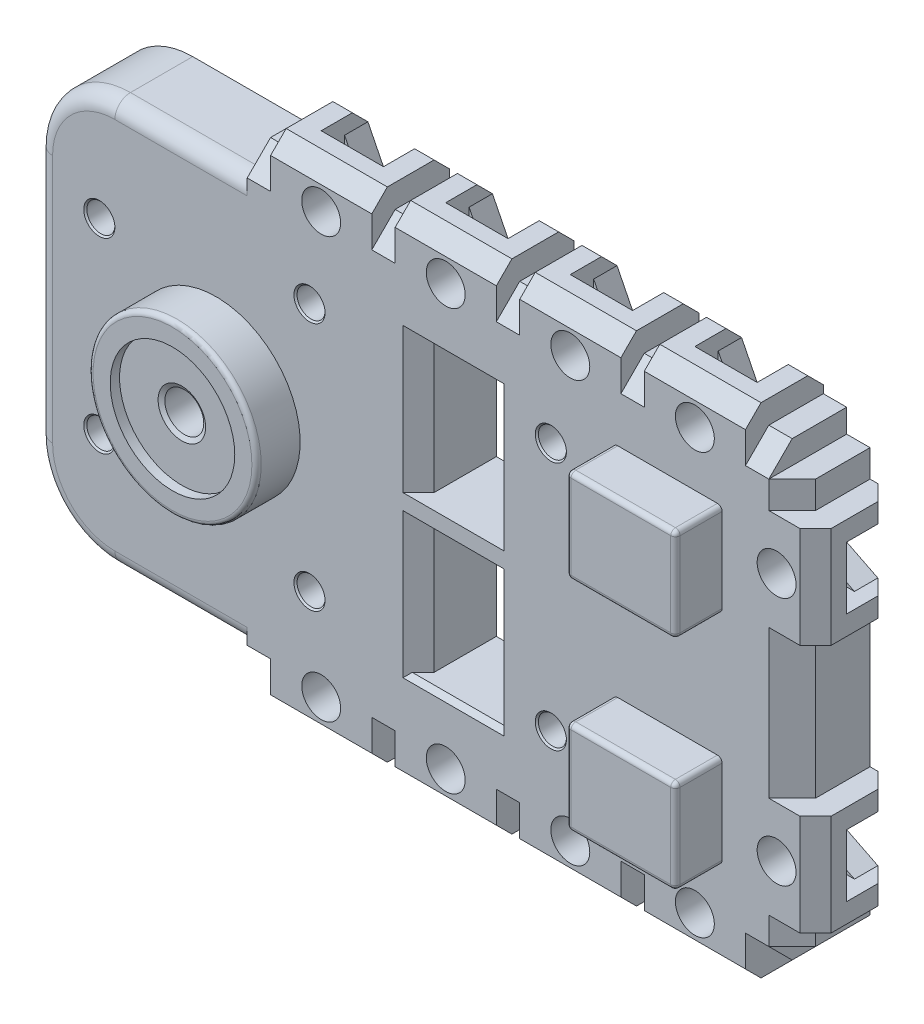
from build123d import *

# Parameters (mm, degrees)
BOSS_EXTRUDE1_DEPTH                  = 2.5
SKETCH5_W                            = 7
SKETCH5_H                            = 6
BOSS_EXTRUDE3_DEPTH                  = 3
SKETCH6_W                            = 3
SKETCH6_H                            = 4
CUT_EXTRUDE3_DEPTH                   = 1
CUT_EXTRUDE4_DEPTH                   = 1.5
CUT_EXTRUDE5_REACH                   = 44.453
SKETCH10_W                           = 4
SKETCH10_H                           = 3
CUT_EXTRUDE6_DEPTH                   = 1
CUT_EXTRUDE7_DEPTH                   = 1.5
CUT_EXTRUDE8_REACH                   = 44.453
CUT_EXTRUDE9_REACH                   = 43.991
SKETCH13_R                           = 1.25
CUT_EXTRUDE10_REACH                  = 43.991
SKETCH14_R                           = 1.25
LPATTERN1_COUNT                      = 4
LPATTERN1_PITCH                      = 8
MIRROR1_COPY_1_SKETCH_W              = 4
MIRROR1_COPY_1_SKETCH_H              = 3
MIRROR1_COPY_1_DEPTH                 = 1
MIRROR1_COPY_2_SKETCH_W              = 4
MIRROR1_COPY_2_SKETCH_H              = 3
MIRROR1_COPY_2_DEPTH                 = 1
MIRROR1_COPY_3_SKETCH_W              = 4
MIRROR1_COPY_3_SKETCH_H              = 3
MIRROR1_COPY_3_DEPTH                 = 1
MIRROR1_COPY_4_DEPTH                 = 1.5
MIRROR1_COPY_5_DEPTH                 = 1.5
MIRROR1_COPY_6_DEPTH                 = 1.5
MIRROR1_COPY_7_REACH                 = 44.453
MIRROR1_COPY_8_REACH                 = 44.453
MIRROR1_COPY_9_REACH                 = 44.453
MIRROR1_COPY_10_REACH                = 43.991
MIRROR1_COPY_10_SKETCH_R             = 1.25
MIRROR1_COPY_11_REACH                = 43.991
MIRROR1_COPY_11_SKETCH_R             = 1.25
MIRROR1_COPY_12_REACH                = 43.991
MIRROR1_COPY_12_SKETCH_R             = 1.25
FILLET1_R                            = 5
SKETCH2_W                            = 4.5
SKETCH2_H                            = 9
CUT_EXTRUDE1_DEPTH                   = 42.991070479
SKETCH3_R                            = 5.4
BOSS_EXTRUDE4_DEPTH                  = 2.8
SKETCH17_R                           = 4
CUT_EXTRUDE13_DEPTH                  = 0.6
F_1_6_1_6_DIAMETER_HOLE1_D           = 1.6
F_1_6_1_6_DIAMETER_HOLE1_DEPTH       = 4.5
F_1_6_1_6_DIAMETER_HOLE1_CSINK_D     = 1.8
F_1_6_1_6_DIAMETER_HOLE1_CSINK_ANGLE = 120
F_1_6_1_6_DIAMETER_HOLE1_TIP         = 0.480688495
M3_TAPPED_HOLE1_D                    = 2.5
M3_TAPPED_HOLE1_CSINK_D              = 3.05
M3_TAPPED_HOLE1_CSINK_ANGLE          = 120
F_1_8_1_8_DIAMETER_HOLE1_D           = 1.8
F_1_8_1_8_DIAMETER_HOLE1_CSINK_D     = 2
F_1_8_1_8_DIAMETER_HOLE1_CSINK_ANGLE = 90
FILLET2_R                            = 1
CHAMFER1_SIZE                        = 1
CHAMFER2_SIZE                        = 1.5
CHAMFER3_SIZE                        = 1
CHAMFER4_SIZE                        = 0.3
FILLET3_R                            = 0.3


with BuildPart() as part:
    # Sketch1 → Boss-Extrude1 (new, symmetric)
    with BuildSketch(Plane.XY):
        Polygon((37, -13), (35.5, -13), (35.5, -14.5), (34, -14.5), (34, -16), (27.5, -16), (27.5, -14.5), (26, -14.5), (26, -16), (19.5, -16), (19.5, -14.5), (18, -14.5), (18, -16), (11.5, -16), (11.5, -14.5), (10, -14.5), (10, -16), (3.5, -16), (3.5, -14.5), (2, -14.5), (2, -13), (-11.5, -13), (-11.5, 13), (2, 13), (2, 14.5), (3.5, 14.5), (3.5, 16), (10, 16), (10, 14.5), (11.5, 14.5), (11.5, 16), (18, 16), (18, 14.5), (19.5, 14.5), (19.5, 16), (26, 16), (26, 14.5), (27.5, 14.5), (27.5, 16), (34, 16), (34, 14.5), (35.5, 14.5), (35.5, 13), (37, 13), (37, 11.25), (38.5, 11.25), (38.5, 4.75), (37, 4.75), (37, -4.75), (38.5, -4.75), (38.5, -11.25), (37, -11.25), align=None)
    extrude(amount=BOSS_EXTRUDE1_DEPTH, both=True)

    # Sketch5 → Boss-Extrude3 (add)
    with BuildSketch(Plane.XY.offset(2.5)):
        with Locations((29, 7)):
            Rectangle(SKETCH5_W, SKETCH5_H)
        with Locations((29, -7)):
            Rectangle(SKETCH5_W, SKETCH5_H)
    extrude(amount=BOSS_EXTRUDE3_DEPTH)

    # Sketch6 → Cut-Extrude3 (cut)
    with BuildSketch(Plane(origin=(38.5, 0, 0), x_dir=(0, 0, -1), z_dir=(1, 0, 0))):
        with Locations((1, 8)):
            Rectangle(SKETCH6_W, SKETCH6_H)
    cut_extrude3 = extrude(amount=-CUT_EXTRUDE3_DEPTH, mode=Mode.SUBTRACT)

    # Sketch7 → Cut-Extrude4 (cut)
    with BuildSketch(Plane(origin=(0, 0, 0.5), x_dir=(-1, 0, 0), z_dir=(0, 0, -1))):
        Polygon((-37.154700538, 6), (-34.845299462, 6), (-33.690598923, 8), (-34.845299462, 10), (-37.154700538, 10), (-38.5, 10), (-38.5, 6), align=None)
    cut_extrude4 = extrude(amount=CUT_EXTRUDE4_DEPTH, mode=Mode.SUBTRACT)

    # Sketch8 → Cut-Extrude5 (cut, up to next)
    with BuildSketch(Plane(origin=(0, 0, -2.5), x_dir=(-1, 0, 0), z_dir=(0, 0, -1)), mode=Mode.PRIVATE) as cut_extrude5_sk1:
        Polygon((-37.5, 10), (-35.5, 9), (-35.5, 7), (-37.5, 6), align=None)
    cut_extrude5_tool1 = extrude(cut_extrude5_sk1.sketch, amount=-CUT_EXTRUDE5_REACH, mode=Mode.PRIVATE) & part.part
    cut_extrude5 = cut_extrude5_tool1.solids().sort_by_distance((36.611111, 8, -2.5))[0]
    add(cut_extrude5, mode=Mode.SUBTRACT)

    # Sketch10 → Cut-Extrude6 (cut)
    with BuildSketch(Plane(origin=(0, 16, 0), x_dir=(1, 0, 0), z_dir=(0, 1, 0))):
        with Locations((30.75, 1)):
            Rectangle(SKETCH10_W, SKETCH10_H)
    cut_extrude6 = extrude(amount=-CUT_EXTRUDE6_DEPTH, mode=Mode.SUBTRACT)

    # Sketch11 → Cut-Extrude7 (cut)
    with BuildSketch(Plane(origin=(0, 0, 0.5), x_dir=(-1, 0, 0), z_dir=(0, 0, -1))):
        Polygon((-32.75, 14.654700538), (-32.75, 12.345299462), (-30.75, 11.190598923), (-28.75, 12.345299462), (-28.75, 14.654700538), (-28.75, 16), (-32.75, 16), align=None)
    cut_extrude7 = extrude(amount=CUT_EXTRUDE7_DEPTH, mode=Mode.SUBTRACT)

    # Sketch12 → Cut-Extrude8 (cut, up to next)
    with BuildSketch(Plane(origin=(0, 0, -2.5), x_dir=(-1, 0, 0), z_dir=(0, 0, -1)), mode=Mode.PRIVATE) as cut_extrude8_sk1:
        Polygon((-28.75, 15), (-29.75, 13), (-31.75, 13), (-32.75, 15), align=None)
    cut_extrude8_tool1 = extrude(cut_extrude8_sk1.sketch, amount=-CUT_EXTRUDE8_REACH, mode=Mode.PRIVATE) & part.part
    cut_extrude8 = cut_extrude8_tool1.solids().sort_by_distance((30.75, 14.111111, -2.5))[0]
    add(cut_extrude8, mode=Mode.SUBTRACT)

    # Sketch13 → Cut-Extrude9 (cut, up to next)
    with BuildSketch(Plane.XY.offset(2.5), mode=Mode.PRIVATE) as cut_extrude9_sk1:
        with Locations((36, 8)):
            Circle(SKETCH13_R)
    cut_extrude9_tool1 = extrude(cut_extrude9_sk1.sketch, amount=-CUT_EXTRUDE9_REACH, mode=Mode.PRIVATE) & part.part
    cut_extrude9 = cut_extrude9_tool1.solids().sort_by_distance((36, 8, 2.5))[0]
    add(cut_extrude9, mode=Mode.SUBTRACT)

    # Sketch14 → Cut-Extrude10 (cut, up to next)
    with BuildSketch(Plane.XY.offset(2.5), mode=Mode.PRIVATE) as cut_extrude10_sk1:
        with Locations((30.75, 13.5)):
            Circle(SKETCH14_R)
    cut_extrude10_tool1 = extrude(cut_extrude10_sk1.sketch, amount=-CUT_EXTRUDE10_REACH, mode=Mode.PRIVATE) & part.part
    cut_extrude10 = cut_extrude10_tool1.solids().sort_by_distance((30.75, 13.5, 2.5))[0]
    add(cut_extrude10, mode=Mode.SUBTRACT)

    # LPattern1: Cut-Extrude6, Cut-Extrude7, Cut-Extrude8, Cut-Extrude10 ×4
    with Locations(*[(-i * LPATTERN1_PITCH, 0, 0) for i in range(1, LPATTERN1_COUNT)]):
        add(cut_extrude6, mode=Mode.SUBTRACT)
        add(cut_extrude7, mode=Mode.SUBTRACT)
        add(cut_extrude8, mode=Mode.SUBTRACT)
        add(cut_extrude10, mode=Mode.SUBTRACT)

    # Mirror1: Cut-Extrude3, Cut-Extrude4, Cut-Extrude5, Cut-Extrude6, Cut-Extrude7, Cut-Extrude8, Cut-Extrude9, Cut-Extrude10 across plane
    add(cut_extrude3.mirror(Plane.ZX), mode=Mode.SUBTRACT)
    add(cut_extrude4.mirror(Plane.ZX), mode=Mode.SUBTRACT)
    add(cut_extrude5.mirror(Plane.ZX), mode=Mode.SUBTRACT)
    add(cut_extrude6.mirror(Plane.ZX), mode=Mode.SUBTRACT)
    add(cut_extrude7.mirror(Plane.ZX), mode=Mode.SUBTRACT)
    add(cut_extrude8.mirror(Plane.ZX), mode=Mode.SUBTRACT)
    add(cut_extrude9.mirror(Plane.ZX), mode=Mode.SUBTRACT)
    add(cut_extrude10.mirror(Plane.ZX), mode=Mode.SUBTRACT)

    # Mirror1 copy 1 sketch → Mirror1 copy 1 (cut)
    with BuildSketch(Plane(origin=(-8, -16, 0), x_dir=(1, 0, 0), z_dir=(0, -1, 0))):
        with Locations((30.75, -1)):
            Rectangle(MIRROR1_COPY_1_SKETCH_W, MIRROR1_COPY_1_SKETCH_H)
    extrude(amount=-MIRROR1_COPY_1_DEPTH, mode=Mode.SUBTRACT)

    # Mirror1 copy 2 sketch → Mirror1 copy 2 (cut)
    with BuildSketch(Plane(origin=(-16, -16, 0), x_dir=(1, 0, 0), z_dir=(0, -1, 0))):
        with Locations((30.75, -1)):
            Rectangle(MIRROR1_COPY_2_SKETCH_W, MIRROR1_COPY_2_SKETCH_H)
    extrude(amount=-MIRROR1_COPY_2_DEPTH, mode=Mode.SUBTRACT)

    # Mirror1 copy 3 sketch → Mirror1 copy 3 (cut)
    with BuildSketch(Plane(origin=(-24, -16, 0), x_dir=(1, 0, 0), z_dir=(0, -1, 0))):
        with Locations((30.75, -1)):
            Rectangle(MIRROR1_COPY_3_SKETCH_W, MIRROR1_COPY_3_SKETCH_H)
    extrude(amount=-MIRROR1_COPY_3_DEPTH, mode=Mode.SUBTRACT)

    # Mirror1 copy 4 sketch → Mirror1 copy 4 (cut)
    with BuildSketch(Plane(origin=(-8, 0, 0.5), x_dir=(-1, 0, 0), z_dir=(0, 0, -1))):
        Polygon((-32.75, -14.654700538), (-32.75, -12.345299462), (-30.75, -11.190598923), (-28.75, -12.345299462), (-28.75, -14.654700538), (-28.75, -16), (-32.75, -16), align=None)
    extrude(amount=MIRROR1_COPY_4_DEPTH, mode=Mode.SUBTRACT)

    # Mirror1 copy 5 sketch → Mirror1 copy 5 (cut)
    with BuildSketch(Plane(origin=(-16, 0, 0.5), x_dir=(-1, 0, 0), z_dir=(0, 0, -1))):
        Polygon((-32.75, -14.654700538), (-32.75, -12.345299462), (-30.75, -11.190598923), (-28.75, -12.345299462), (-28.75, -14.654700538), (-28.75, -16), (-32.75, -16), align=None)
    extrude(amount=MIRROR1_COPY_5_DEPTH, mode=Mode.SUBTRACT)

    # Mirror1 copy 6 sketch → Mirror1 copy 6 (cut)
    with BuildSketch(Plane(origin=(-24, 0, 0.5), x_dir=(-1, 0, 0), z_dir=(0, 0, -1))):
        Polygon((-32.75, -14.654700538), (-32.75, -12.345299462), (-30.75, -11.190598923), (-28.75, -12.345299462), (-28.75, -14.654700538), (-28.75, -16), (-32.75, -16), align=None)
    extrude(amount=MIRROR1_COPY_6_DEPTH, mode=Mode.SUBTRACT)

    # Mirror1 copy 7 sketch → Mirror1 copy 7 (cut, up to next)
    with BuildSketch(Plane(origin=(-8, 0, -2.5), x_dir=(-1, 0, 0), z_dir=(0, 0, -1)), mode=Mode.PRIVATE) as mirror1_copy_7_sk1:
        Polygon((-28.75, -15), (-29.75, -13), (-31.75, -13), (-32.75, -15), align=None)
    mirror1_copy_7_tool1 = extrude(mirror1_copy_7_sk1.sketch, amount=-MIRROR1_COPY_7_REACH, mode=Mode.PRIVATE) & part.part
    add(mirror1_copy_7_tool1.solids().sort_by_distance((22.75, -14.111111, -2.5))[0], mode=Mode.SUBTRACT)

    # Mirror1 copy 8 sketch → Mirror1 copy 8 (cut, up to next)
    with BuildSketch(Plane(origin=(-16, 0, -2.5), x_dir=(-1, 0, 0), z_dir=(0, 0, -1)), mode=Mode.PRIVATE) as mirror1_copy_8_sk1:
        Polygon((-28.75, -15), (-29.75, -13), (-31.75, -13), (-32.75, -15), align=None)
    mirror1_copy_8_tool1 = extrude(mirror1_copy_8_sk1.sketch, amount=-MIRROR1_COPY_8_REACH, mode=Mode.PRIVATE) & part.part
    add(mirror1_copy_8_tool1.solids().sort_by_distance((14.75, -14.111111, -2.5))[0], mode=Mode.SUBTRACT)

    # Mirror1 copy 9 sketch → Mirror1 copy 9 (cut, up to next)
    with BuildSketch(Plane(origin=(-24, 0, -2.5), x_dir=(-1, 0, 0), z_dir=(0, 0, -1)), mode=Mode.PRIVATE) as mirror1_copy_9_sk1:
        Polygon((-28.75, -15), (-29.75, -13), (-31.75, -13), (-32.75, -15), align=None)
    mirror1_copy_9_tool1 = extrude(mirror1_copy_9_sk1.sketch, amount=-MIRROR1_COPY_9_REACH, mode=Mode.PRIVATE) & part.part
    add(mirror1_copy_9_tool1.solids().sort_by_distance((6.75, -14.111111, -2.5))[0], mode=Mode.SUBTRACT)

    # Mirror1 copy 10 sketch → Mirror1 copy 10 (cut, up to next)
    with BuildSketch(Plane(origin=(-8, 0, 2.5), x_dir=(1, 0, 0), z_dir=(0, 0, 1)), mode=Mode.PRIVATE) as mirror1_copy_10_sk1:
        with Locations((30.75, -13.5)):
            Circle(MIRROR1_COPY_10_SKETCH_R)
    mirror1_copy_10_tool1 = extrude(mirror1_copy_10_sk1.sketch, amount=-MIRROR1_COPY_10_REACH, mode=Mode.PRIVATE) & part.part
    add(mirror1_copy_10_tool1.solids().sort_by_distance((22.75, -13.5, 2.5))[0], mode=Mode.SUBTRACT)

    # Mirror1 copy 11 sketch → Mirror1 copy 11 (cut, up to next)
    with BuildSketch(Plane(origin=(-16, 0, 2.5), x_dir=(1, 0, 0), z_dir=(0, 0, 1)), mode=Mode.PRIVATE) as mirror1_copy_11_sk1:
        with Locations((30.75, -13.5)):
            Circle(MIRROR1_COPY_11_SKETCH_R)
    mirror1_copy_11_tool1 = extrude(mirror1_copy_11_sk1.sketch, amount=-MIRROR1_COPY_11_REACH, mode=Mode.PRIVATE) & part.part
    add(mirror1_copy_11_tool1.solids().sort_by_distance((14.75, -13.5, 2.5))[0], mode=Mode.SUBTRACT)

    # Mirror1 copy 12 sketch → Mirror1 copy 12 (cut, up to next)
    with BuildSketch(Plane(origin=(-24, 0, 2.5), x_dir=(1, 0, 0), z_dir=(0, 0, 1)), mode=Mode.PRIVATE) as mirror1_copy_12_sk1:
        with Locations((30.75, -13.5)):
            Circle(MIRROR1_COPY_12_SKETCH_R)
    mirror1_copy_12_tool1 = extrude(mirror1_copy_12_sk1.sketch, amount=-MIRROR1_COPY_12_REACH, mode=Mode.PRIVATE) & part.part
    add(mirror1_copy_12_tool1.solids().sort_by_distance((6.75, -13.5, 2.5))[0], mode=Mode.SUBTRACT)

    # Fillet1
    fillet1_edges = [part.edges().sort_by_distance(p)[0] for p in [
        (-11.5, -13, 0),
        (-11.5, 13, 0),
    ]]
    fillet(fillet1_edges, radius=FILLET1_R)

    # Sketch2 → Cut-Extrude1 (cut, through all)
    with BuildSketch(Plane.XY.offset(2.5)):
        with Locations((15.25, 5)):
            Rectangle(SKETCH2_W, SKETCH2_H)
        with Locations((15.25, -5)):
            Rectangle(SKETCH2_W, SKETCH2_H)
    extrude(amount=-CUT_EXTRUDE1_DEPTH, mode=Mode.SUBTRACT)

    # Sketch3 → Boss-Extrude4 (add)
    with BuildSketch(Plane.XY.offset(2.5)):
        with Locations(Location((0, 0, 0), (0, 0, 180))):
            Circle(SKETCH3_R)
    extrude(amount=BOSS_EXTRUDE4_DEPTH)

    # Sketch17 → Cut-Extrude13 (cut)
    with BuildSketch(Plane.XY.offset(5.3)):
        Circle(SKETCH17_R)
    extrude(amount=-CUT_EXTRUDE13_DEPTH, mode=Mode.SUBTRACT)

    # Ø1.6 (1.6) Diameter Hole1
    with Locations(Plane(origin=(0, 0, -2.5), x_dir=(-1, 0, 0), z_dir=(0, 0, -1))):
        with Locations((-33, 10.4), (-33, -10.4), (9, 9.25), (9, -9.25)):
            CounterSinkHole(F_1_6_1_6_DIAMETER_HOLE1_D / 2, F_1_6_1_6_DIAMETER_HOLE1_CSINK_D / 2, depth=F_1_6_1_6_DIAMETER_HOLE1_DEPTH, counter_sink_angle=F_1_6_1_6_DIAMETER_HOLE1_CSINK_ANGLE)
            with Locations((0, 0, -(F_1_6_1_6_DIAMETER_HOLE1_DEPTH + F_1_6_1_6_DIAMETER_HOLE1_TIP / 2))):  # 118° drill point
                Cone(0, F_1_6_1_6_DIAMETER_HOLE1_D / 2, F_1_6_1_6_DIAMETER_HOLE1_TIP, mode=Mode.SUBTRACT)

    # M3 Tapped Hole1 (through all)
    with Locations(Plane.XY.offset(4.7)):
        with Locations((0, 0)):
            CounterSinkHole(M3_TAPPED_HOLE1_D / 2, M3_TAPPED_HOLE1_CSINK_D / 2, counter_sink_angle=M3_TAPPED_HOLE1_CSINK_ANGLE)

    # Ø1.8 (1.8) Diameter Hole1 (through all)
    with Locations(Plane.XY.offset(2.5)):
        with Locations((6, 8), (21.5, 8), (-7.5, 6), (21.5, -8), (6, -8), (-7.5, -6)):
            CounterSinkHole(F_1_8_1_8_DIAMETER_HOLE1_D / 2, F_1_8_1_8_DIAMETER_HOLE1_CSINK_D / 2, counter_sink_angle=F_1_8_1_8_DIAMETER_HOLE1_CSINK_ANGLE)

    # Fillet2
    fillet2_edges = [part.edges().sort_by_distance(p)[0] for p in [
        (-2.25, 13, 2.5),
        (-2.25, -13, 2.5),
        (-11.5, 0, 2.5),
        (-10.035533906, 11.535533906, 2.5),
        (-10.035533906, -11.535533906, 2.5),
    ]]
    fillet(fillet2_edges, radius=FILLET2_R)

    # Chamfer1
    chamfer1_edges = [part.edges().sort_by_distance(p)[0] for p in [
        (4.125, -16, -2.5),
        (9.375, -16, -2.5),
        (12.125, -16, -2.5),
        (17.375, -16, -2.5),
        (20.125, -16, -2.5),
        (25.375, -16, -2.5),
        (28.125, -16, -2.5),
        (33.375, -16, -2.5),
        (4.125, 16, -2.5),
        (9.375, 16, -2.5),
        (12.125, 16, -2.5),
        (17.375, 16, -2.5),
        (20.125, 16, -2.5),
        (25.375, 16, -2.5),
        (28.125, 16, -2.5),
        (33.375, 16, -2.5),
        (38.5, -10.625, -2.5),
        (38.5, -5.375, -2.5),
        (38.5, 5.375, -2.5),
        (38.5, 10.625, -2.5),
        (6.75, 16, 2.5),
        (14.75, 16, 2.5),
        (22.75, 16, 2.5),
        (30.75, 16, 2.5),
        (38.5, 8, 2.5),
        (38.5, -8, 2.5),
        (30.75, -16, 2.5),
        (22.75, -16, 2.5),
        (14.75, -16, 2.5),
        (6.75, -16, 2.5),
    ]]
    chamfer(chamfer1_edges, length=CHAMFER1_SIZE)

    # Chamfer2
    chamfer2_edges = [part.edges().sort_by_distance(p)[0] for p in [
        (34.75, 14.5, 2.5),
        (26.75, 14.5, 2.5),
        (18.75, 14.5, 2.5),
        (10.75, 14.5, 2.5),
        (2.75, 14.5, 2.5),
        (2.75, -14.5, 2.5),
        (10.75, -14.5, 2.5),
        (18.75, -14.5, 2.5),
        (26.75, -14.5, 2.5),
        (34.75, -14.5, 2.5),
        (37, -12.125, 2.5),
        (37, 0, 2.5),
        (37, 12.125, 2.5),
    ]]
    chamfer(chamfer2_edges, length=CHAMFER2_SIZE)

    # Chamfer3
    chamfer3_edges = [part.edges().sort_by_distance(p)[0] for p in [
        (17.5, 5, 2.5),
        (13, 5, 2.5),
        (17.5, -5, 2.5),
        (13, -5, 2.5),
    ]]
    chamfer(chamfer3_edges, length=CHAMFER3_SIZE)

    # Chamfer4
    chamfer4_edges = [part.edges().sort_by_distance(p)[0] for p in [
        (15.25, 9.5, 2.5),
        (15.25, -9.5, 2.5),
    ]]
    chamfer(chamfer4_edges, length=CHAMFER4_SIZE)

    # Fillet3
    fillet3_edges = [part.edges().sort_by_distance(p)[0] for p in [
        (32.5, 4, 4),
        (32.5, 10, 4),
        (25.5, 10, 4),
        (25.5, 4, 4),
        (32.5, 7, 5.5),
        (29, 10, 5.5),
        (25.5, 7, 5.5),
        (29, 4, 5.5),
        (25.5, -10, 4),
        (32.5, -10, 4),
        (32.5, -4, 4),
        (25.5, -4, 4),
        (29, -10, 5.5),
        (32.5, -7, 5.5),
        (29, -4, 5.5),
        (25.5, -7, 5.5),
        (5.4, 0, 5.3),
    ]]
    fillet(fillet3_edges, radius=FILLET3_R)


solid = part.part
